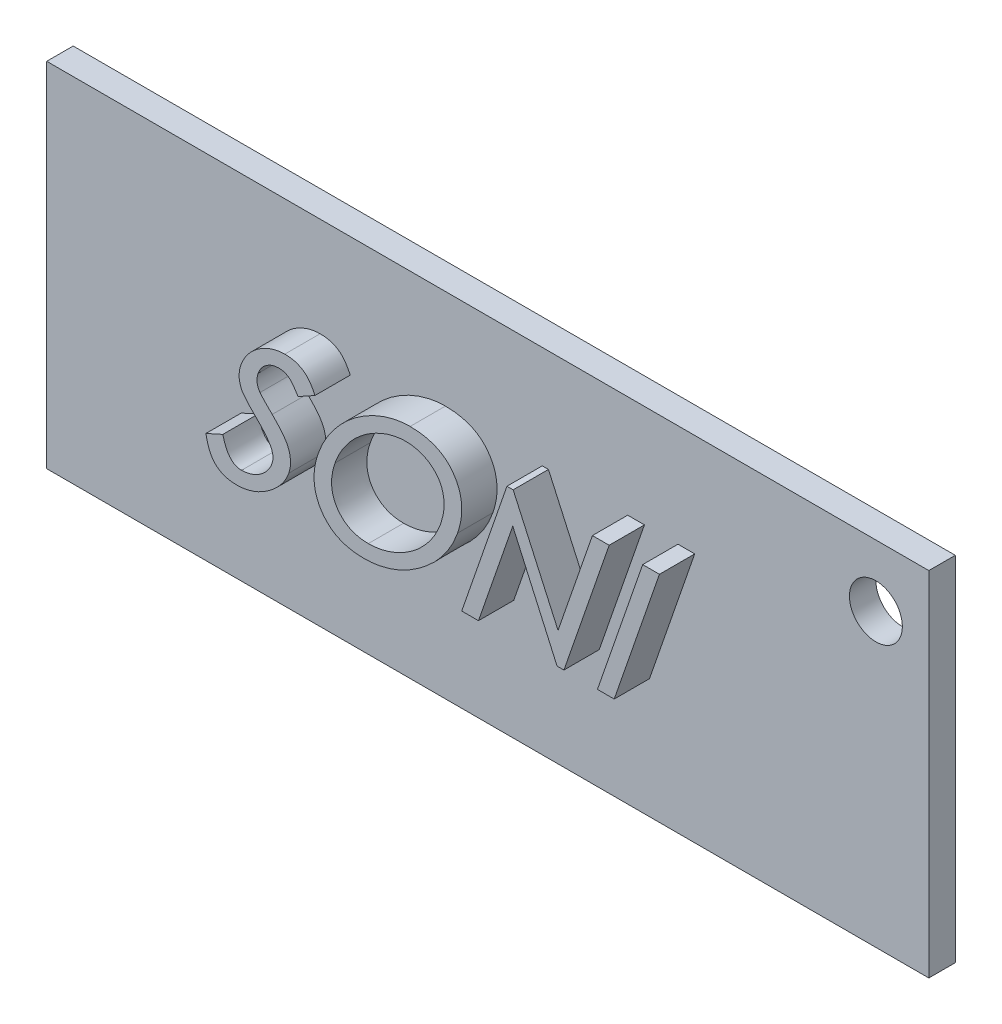
from build123d import *

# Parameters (mm, degrees)
SKETCH1_W           = 50
SKETCH1_H           = 20
BOSS_EXTRUDE1_DEPTH = 1.5
BOSS_EXTRUDE2_DEPTH = 2
SKETCH3_R           = 1.5
CUT_EXTRUDE1_DEPTH  = 2


with BuildPart() as part:
    # Sketch1 → Boss-Extrude1 (new body)
    with BuildSketch(Plane.XY):
        Rectangle(SKETCH1_W, SKETCH1_H)
    extrude(amount=BOSS_EXTRUDE1_DEPTH)

    # Sketch2 → Boss-Extrude2 (add)
    # profile 1 of 4: a face of its own
    with BuildSketch(Plane.XY.offset(1.5)):
        with BuildLine():
            Line((-13.974407972, -1.754997377), (-13.018685483, -1.324625449))
            add(Edge.make_bspline(
                [(-13.018685483, -1.324625449), (-12.993364568, -1.42166974), (-12.945414566, -1.605441693), (-12.848529546, -1.857451647), (-12.739942289, -2.072648376), (-12.61504846, -2.249545476), (-12.474055014, -2.388564201), (-12.316339112, -2.487707893), (-12.14297045, -2.548777648), (-12.021894937, -2.555793694), (-11.960564155, -2.559347671)],
                knots=[0, 0, 0, 0, 1.366242747, 2.587242303, 3.672994386, 4.644237624, 5.526474312, 6.353482186, 7.165956663, 8, 8, 8, 8], degree=3))
            add(Edge.make_bspline(
                [(-11.960564155, -2.559347671), (-11.900083725, -2.557296868), (-11.777358448, -2.553135435), (-11.593895672, -2.52041494), (-11.409012272, -2.469420024), (-11.225675647, -2.398665213), (-11.048322302, -2.310758517), (-10.88204974, -2.208380004), (-10.732148298, -2.090440819), (-10.597143765, -1.961541441), (-10.478446544, -1.823733448), (-10.377894757, -1.680683106), (-10.295137781, -1.53325765), (-10.25569109, -1.430531741), (-10.236108359, -1.379534971)],
                knots=[0, 0, 0, 0, 0.982389124, 1.993437814, 3.019335133, 4.095770719, 5.181531962, 6.23223351, 7.263064189, 8.275167036, 9.261364393, 10.213689592, 11.113212396, 12, 12, 12, 12], degree=3))
            add(Edge.make_bspline(
                [(-10.236108359, -1.379534971), (-10.219226733, -1.322574983), (-10.186080966, -1.21073845), (-10.171898073, -1.037182781), (-10.187143753, -0.864251701), (-10.222558444, -0.754267429), (-10.240560483, -0.698360091)],
                knots=[0, 0, 0, 0, 1.023665939, 2.009888962, 2.98838436, 4, 4, 4, 4], degree=3))
            add(Edge.make_bspline(
                [(-10.240560483, -0.698360091), (-10.257594599, -0.657915385), (-10.293555512, -0.572532119), (-10.366370183, -0.446189922), (-10.452596268, -0.312520238), (-10.55379879, -0.172117339), (-10.673253971, -0.027801546), (-10.806885161, 0.12411861), (-10.957451218, 0.281478827), (-11.064887481, 0.386780805), (-11.120596874, 0.441383499)],
                knots=[0, 0, 0, 0, 0.725921294, 1.53250051, 2.409358469, 3.35948991, 4.395527304, 5.509549822, 6.708616029, 8, 8, 8, 8], degree=3))
            add(Edge.make_bspline(
                [(-11.120596874, 0.441383499), (-11.177887412, 0.4963869), (-11.287421786, 0.601548474), (-11.43761624, 0.758078177), (-11.57287838, 0.899625927), (-11.686511858, 1.032743745), (-11.785431807, 1.151576703), (-11.863980376, 1.260535914), (-11.927004746, 1.355956276), (-11.956240391, 1.419026516), (-11.969468402, 1.447563387)],
                knots=[0, 0, 0, 0, 1.440931207, 2.754931364, 3.936117262, 4.992495269, 5.930372775, 6.740127158, 7.429955742, 8, 8, 8, 8], degree=3))
            add(Edge.make_bspline(
                [(-11.969468402, 1.447563387), (-11.987648022, 1.49176727), (-12.023826024, 1.579734356), (-12.062697609, 1.717461392), (-12.085769123, 1.858357451), (-12.09675556, 2.001923556), (-12.092066935, 2.148159206), (-12.071969454, 2.296977466), (-12.039666693, 2.44899459), (-12.007915886, 2.549450139), (-11.991729019, 2.600663347)],
                knots=[0, 0, 0, 0, 0.969882978, 1.930096936, 2.897689013, 3.864446688, 4.849193057, 5.86201719, 6.910035748, 8, 8, 8, 8], degree=3))
            add(Edge.make_bspline(
                [(-11.991729019, 2.600663347), (-11.960946721, 2.681633146), (-11.8989025, 2.844834355), (-11.771079087, 3.075575555), (-11.617875356, 3.295840338), (-11.440771341, 3.503987333), (-11.240808473, 3.696175353), (-11.022724971, 3.869146538), (-10.786102977, 4.017742567), (-10.536920831, 4.144804389), (-10.279609702, 4.246725663), (-10.019677689, 4.320262746), (-9.760774984, 4.364831989), (-9.588241864, 4.371030013), (-9.50299204, 4.3740925)],
                knots=[0, 0, 0, 0, 0.960482324, 1.935930141, 2.918338052, 3.934950457, 4.964001294, 5.99217285, 7.018862584, 8.06002957, 9.092896566, 10.08544053, 11.054002747, 12, 12, 12, 12], degree=3))
            add(Edge.make_bspline(
                [(-9.50299204, 4.3740925), (-9.409328331, 4.370865958), (-9.228224675, 4.364627271), (-8.966348002, 4.319208033), (-8.727535253, 4.237922418), (-8.543309239, 4.146011369), (-8.407898239, 4.052586), (-8.310280766, 3.969266339), (-8.215693456, 3.87273178), (-8.124517152, 3.763488718), (-8.036230017, 3.640501048), (-7.952382939, 3.504412734), (-7.87204409, 3.354817706), (-7.82211318, 3.249906581), (-7.796344737, 3.195763841)],
                knots=[0, 0, 0, 0, 1.517209808, 2.933604147, 4.286903352, 5.591513207, 6.253966455, 6.947629261, 7.667329603, 8.441002673, 9.250575696, 10.117904152, 11.028684271, 12, 12, 12, 12], degree=3))
            Line((-7.796344737, 3.195763841), (-8.755035309, 2.664477115))
            add(Edge.make_bspline(
                [(-8.755035309, 2.664477115), (-8.780573436, 2.707622626), (-8.829668615, 2.790566712), (-8.90346336, 2.908500623), (-8.976679968, 3.012905725), (-9.044223235, 3.108188602), (-9.112230974, 3.188594517), (-9.176810104, 3.258239198), (-9.238012011, 3.316331526), (-9.318002542, 3.375994871), (-9.422840557, 3.433938935), (-9.558420415, 3.485487769), (-9.707698976, 3.512857419), (-9.810583677, 3.517098703), (-9.863614035, 3.519284808)],
                knots=[0, 0, 0, 0, 1.215895862, 2.337470802, 3.372356939, 4.308146137, 5.168290878, 5.923677575, 6.611245207, 7.211060785, 8.338969284, 9.504341646, 10.713650776, 12, 12, 12, 12], degree=3))
            add(Edge.make_bspline(
                [(-9.863614035, 3.519284808), (-9.923235305, 3.516315308), (-10.043020192, 3.510349296), (-10.219742319, 3.465032832), (-10.392590395, 3.393197477), (-10.556772079, 3.292035731), (-10.709259256, 3.169796488), (-10.837807634, 3.023859983), (-10.943505555, 2.859548848), (-10.991024892, 2.738174331), (-11.015229954, 2.676349444)],
                knots=[0, 0, 0, 0, 0.941623222, 1.891811974, 2.866273965, 3.890870804, 4.930192469, 5.943899404, 6.952678138, 8, 8, 8, 8], degree=3))
            add(Edge.make_bspline(
                [(-11.015229954, 2.676349444), (-11.027981537, 2.637011963), (-11.053009737, 2.559802225), (-11.074789806, 2.442674602), (-11.084193196, 2.328754897), (-11.080165546, 2.217458722), (-11.060297912, 2.107704637), (-11.025849968, 1.999058838), (-10.976190568, 1.890251013), (-10.932506424, 1.821540441), (-10.909863033, 1.785924765)],
                knots=[0, 0, 0, 0, 1.061690431, 2.083835451, 3.05291063, 3.994329682, 4.936863702, 5.909766272, 6.916541013, 8, 8, 8, 8], degree=3))
            add(Edge.make_bspline(
                [(-10.909863033, 1.785924765), (-10.897687061, 1.769448347), (-10.870071426, 1.732079112), (-10.818071654, 1.672490698), (-10.752775877, 1.599773521), (-10.673386954, 1.514407685), (-10.578818028, 1.417498483), (-10.470951872, 1.308197071), (-10.349188219, 1.186069684), (-10.262445043, 1.101661513), (-10.216815824, 1.057260569)],
                knots=[0, 0, 0, 0, 0.488404034, 1.107721659, 1.884627782, 2.819503016, 3.887381442, 5.113651768, 6.481704013, 8, 8, 8, 8], degree=3))
            add(Edge.make_bspline(
                [(-10.216815824, 1.057260569), (-10.155087341, 0.996806545), (-10.035602952, 0.879789059), (-9.868550419, 0.703597621), (-9.72239839, 0.531075938), (-9.591635317, 0.366690927), (-9.4816069, 0.20646512), (-9.390681471, 0.051582966), (-9.316642498, -0.096640265), (-9.246202012, -0.285570984), (-9.192167793, -0.519995156), (-9.170023198, -0.80180398), (-9.196072213, -1.08441731), (-9.250045415, -1.265459345), (-9.277417788, -1.357274354)],
                knots=[0, 0, 0, 0, 1.126961503, 2.18139661, 3.16540865, 4.075407739, 4.920159245, 5.698125861, 6.416667466, 7.078222902, 8.324060742, 9.540477173, 10.752659238, 12, 12, 12, 12], degree=3))
            add(Edge.make_bspline(
                [(-9.277417788, -1.357274354), (-9.302349945, -1.423626934), (-9.352671061, -1.557547792), (-9.452452252, -1.749561371), (-9.566412636, -1.938146812), (-9.701428589, -2.119665296), (-9.854400358, -2.29604891), (-10.025611921, -2.467038278), (-10.21528545, -2.631579456), (-10.418710518, -2.790858196), (-10.634397741, -2.935348921), (-10.854470153, -3.064805245), (-11.079298143, -3.171533649), (-11.307216068, -3.259099331), (-11.53787689, -3.330204892), (-11.772405276, -3.378758257), (-12.0103034, -3.407532724), (-12.169736158, -3.411938612), (-12.249952176, -3.414155363)],
                knots=[0, 0, 0, 0, 0.888474965, 1.793228361, 2.709591257, 3.650401977, 4.627082336, 5.636340541, 6.683060695, 7.775419217, 8.87524379, 9.937485282, 10.975616154, 11.993234322, 12.998363101, 14.000018463, 14.993741594, 16, 16, 16, 16], degree=3))
            add(Edge.make_bspline(
                [(-12.249952176, -3.414155363), (-12.306376638, -3.412887599), (-12.416991483, -3.410402268), (-12.579467253, -3.394660852), (-12.733230185, -3.364848837), (-12.878861713, -3.323967362), (-13.017520222, -3.274920716), (-13.146758724, -3.209661229), (-13.269216458, -3.135913374), (-13.383504142, -3.049227499), (-13.488228568, -2.94676129), (-13.585313639, -2.828753506), (-13.673286274, -2.693010234), (-13.749229515, -2.538041314), (-13.821523037, -2.367856106), (-13.880990499, -2.178654389), (-13.933238492, -1.972964396), (-13.960360296, -1.829371163), (-13.974407972, -1.754997377)],
                knots=[0, 0, 0, 0, 1.016743274, 1.993229434, 2.937199628, 3.834660296, 4.717258582, 5.582263595, 6.438313194, 7.290455994, 8.16031522, 9.07217833, 10.038851953, 11.067287897, 12.178024352, 13.367542962, 14.636524905, 16, 16, 16, 16], degree=3))
        make_face()
    # profile 2 of 4: a face of its own
    with BuildSketch(Plane.XY.offset(1.5)):
        with BuildLine():
            add(Edge.make_bspline(
                [(-2.40037118, 4.3740925), (-2.329115812, 4.373266408), (-2.188950149, 4.371641412), (-1.982444266, 4.357970494), (-1.783340345, 4.335922127), (-1.59207346, 4.305034548), (-1.408766941, 4.264866969), (-1.23330481, 4.215980388), (-1.065284666, 4.158046511), (-0.904941175, 4.091627788), (-0.752862291, 4.015464985), (-0.608524045, 3.930775238), (-0.471623101, 3.837092008), (-0.342261172, 3.734376305), (-0.220246797, 3.623291716), (-0.10723324, 3.502219238), (-0.001576929, 3.372851309), (0.095719455, 3.235277912), (0.184813532, 3.091744708), (0.26328361, 2.943323294), (0.331718388, 2.791669108), (0.390355954, 2.636203256), (0.437180257, 2.476813045), (0.47441702, 2.313685909), (0.50282455, 2.147296162), (0.521047346, 1.976795242), (0.525895413, 1.802274885), (0.523492709, 1.624433065), (0.509896096, 1.443084531), (0.485657119, 1.257904281), (0.452074856, 1.069064514), (0.406251147, 0.876873741), (0.353987901, 0.680164051), (0.309754165, 0.549486585), (0.287227311, 0.482936651)],
                knots=[0, 0, 0, 0, 1.19369531, 2.348105145, 3.465600306, 4.548794009, 5.592458661, 6.60793664, 7.598661093, 8.568328124, 9.513458989, 10.445895592, 11.370007858, 12.290284303, 13.211269529, 14.131807167, 15.062474159, 16.007605024, 16.952881227, 17.89086296, 18.81820283, 19.738740468, 20.672281375, 21.599102619, 22.540592751, 23.498859082, 24.469092632, 25.463761039, 26.477614361, 27.513815442, 28.591637562, 29.689287715, 30.823226709, 32, 32, 32, 32], degree=3))
            add(Edge.make_bspline(
                [(0.287227311, 0.482936651), (0.237898348, 0.350966912), (0.139435589, 0.087549567), (-0.046652769, -0.292676621), (-0.264360672, -0.657982584), (-0.51089536, -1.010996172), (-0.789712849, -1.348018713), (-1.098330785, -1.67173653), (-1.438840117, -1.979726782), (-1.805008488, -2.270895837), (-2.18828956, -2.537332803), (-2.58083408, -2.771374651), (-2.978403443, -2.970003822), (-3.380696037, -3.132485297), (-3.788553555, -3.257547745), (-4.20069104, -3.348956387), (-4.618518788, -3.403734041), (-4.898844125, -3.410681762), (-5.038996313, -3.414155363)],
                knots=[0, 0, 0, 0, 0.965800603, 1.927780069, 2.898282571, 3.879946096, 4.877733712, 5.89516875, 6.944716955, 8.024001756, 9.101562889, 10.143627197, 11.155617605, 12.146599204, 13.115635926, 14.077908484, 15.039026101, 16, 16, 16, 16], degree=3))
            add(Edge.make_bspline(
                [(-5.038996313, -3.414155363), (-5.106295635, -3.413320037), (-5.239050615, -3.411672267), (-5.434189598, -3.398091601), (-5.622465182, -3.376092746), (-5.80348886, -3.344175435), (-5.978588085, -3.307363049), (-6.145273418, -3.256532068), (-6.306039099, -3.202158966), (-6.457781829, -3.132958307), (-6.605298873, -3.060999127), (-6.742929104, -2.974329259), (-6.87627929, -2.883845379), (-6.998887053, -2.779780784), (-7.116869704, -2.669926427), (-7.228443183, -2.551743931), (-7.330770895, -2.422752296), (-7.426861761, -2.287283558), (-7.51431816, -2.145112698), (-7.591688171, -1.99787074), (-7.658446023, -1.846561692), (-7.714548532, -1.691624538), (-7.762822398, -1.533872542), (-7.799581535, -1.372138738), (-7.826521337, -1.206604457), (-7.842625079, -1.037556823), (-7.848669664, -0.864587103), (-7.843519959, -0.687763215), (-7.830643204, -0.506901991), (-7.806623739, -0.322630085), (-7.772155371, -0.134973094), (-7.727692532, 0.056213389), (-7.672345904, 0.251054576), (-7.629599993, 0.381176472), (-7.607871514, 0.447319663)],
                knots=[0, 0, 0, 0, 1.152857882, 2.274133261, 3.349502609, 4.398637837, 5.422655992, 6.41218139, 7.382466674, 8.327287206, 9.267230032, 10.191647644, 11.110884003, 12.025616675, 12.942975922, 13.872314084, 14.806739057, 15.761390706, 16.716343246, 17.664048038, 18.60886857, 19.547243644, 20.485618719, 21.433361403, 22.386356454, 23.356974782, 24.340639887, 25.349465624, 26.386204989, 27.445796577, 28.531270378, 29.653698147, 30.807334513, 32, 32, 32, 32], degree=3))
            add(Edge.make_bspline(
                [(-7.607871514, 0.447319663), (-7.575728616, 0.535766327), (-7.511273989, 0.713124225), (-7.396071658, 0.972971975), (-7.266577378, 1.228149264), (-7.124554058, 1.479442028), (-6.966376562, 1.724737858), (-6.794014735, 1.965434818), (-6.607081995, 2.200994097), (-6.406928636, 2.430679981), (-6.196384411, 2.651434011), (-5.977459339, 2.861873523), (-5.750768211, 3.059212644), (-5.515677384, 3.242825089), (-5.274833875, 3.416341209), (-5.025446224, 3.575567914), (-4.769964647, 3.725538595), (-4.506456169, 3.858789394), (-4.24134818, 3.98104774), (-3.974646482, 4.084271385), (-3.710172957, 4.174511568), (-3.446408159, 4.246695152), (-3.183487507, 4.304287807), (-2.921626095, 4.343054028), (-2.660665082, 4.370641293), (-2.487011703, 4.372943743), (-2.40037118, 4.3740925)],
                knots=[0, 0, 0, 0, 0.980143043, 1.96543435, 2.958765697, 3.960404016, 4.971069614, 5.997885197, 7.043373198, 8.102652665, 9.170658746, 10.220367732, 11.265106092, 12.300165184, 13.326980766, 14.356224728, 15.38153908, 16.411775992, 17.431115419, 18.421608671, 19.389632625, 20.341067018, 21.268972419, 22.191682806, 23.097780028, 24, 24, 24, 24], degree=3))
        make_face()
        with BuildLine():
            add(Edge.make_bspline(
                [(-2.666014542, 3.519284808), (-2.728889823, 3.518243144), (-2.85592221, 3.516138579), (-3.047174589, 3.495593089), (-3.240897844, 3.464483423), (-3.436999882, 3.420999399), (-3.635984964, 3.366586664), (-3.836233338, 3.297534821), (-4.039011682, 3.217333245), (-4.242206458, 3.123952484), (-4.444470668, 3.020930837), (-4.642067504, 2.907993318), (-4.834231982, 2.785724989), (-5.02128502, 2.65453818), (-5.200292439, 2.510678816), (-5.376485508, 2.360815918), (-5.547233955, 2.201182906), (-5.70901769, 2.030259963), (-5.86571766, 1.854483537), (-6.01052574, 1.670863168), (-6.144367066, 1.48109045), (-6.269798863, 1.287416354), (-6.382050776, 1.085835341), (-6.486246082, 0.880423546), (-6.579222272, 0.668449241), (-6.631685017, 0.523319549), (-6.658085189, 0.450287746)],
                knots=[0, 0, 0, 0, 0.848377632, 1.714050969, 2.593290597, 3.495650987, 4.423826135, 5.376087873, 6.353097408, 7.365974628, 8.393186759, 9.415962607, 10.436556764, 11.466542689, 12.497826262, 13.534886172, 14.588239105, 15.650778183, 16.710397299, 17.765674127, 18.804966953, 19.844002381, 20.878393667, 21.917514901, 22.952057019, 24, 24, 24, 24], degree=3))
            add(Edge.make_bspline(
                [(-6.658085189, 0.450287746), (-6.692224441, 0.344978376), (-6.758187172, 0.141503101), (-6.821877106, -0.163847783), (-6.856050947, -0.454987619), (-6.857008116, -0.733028167), (-6.824027315, -0.997208387), (-6.76048315, -1.247829014), (-6.664691728, -1.485325627), (-6.536881928, -1.705037852), (-6.384849062, -1.905102639), (-6.210923234, -2.080344716), (-6.018724514, -2.230489517), (-5.805354417, -2.351291331), (-5.573307251, -2.445301545), (-5.322466999, -2.511317692), (-5.052715755, -2.552407761), (-4.866507093, -2.556984913), (-4.770384868, -2.559347671)],
                knots=[0, 0, 0, 0, 1.239344653, 2.394620662, 3.487546551, 4.518238436, 5.501106608, 6.46206435, 7.406698664, 8.360020979, 9.300974908, 10.213954007, 11.118417775, 12.024306323, 12.951452884, 13.91521849, 14.923821074, 16, 16, 16, 16], degree=3))
            add(Edge.make_bspline(
                [(-4.770384868, -2.559347671), (-4.70059016, -2.558310268), (-4.560240186, -2.556224157), (-4.350170195, -2.535931362), (-4.139698763, -2.504533884), (-3.928855299, -2.46203896), (-3.717734653, -2.404513491), (-3.505650071, -2.337320166), (-3.294374683, -2.254159822), (-3.082820999, -2.161875987), (-2.875509087, -2.056486343), (-2.672302195, -1.943796872), (-2.476166013, -1.820366693), (-2.287077276, -1.68681866), (-2.103240951, -1.545464204), (-1.927003216, -1.394252189), (-1.757654372, -1.233276749), (-1.594591622, -1.064992285), (-1.441216673, -0.888640907), (-1.296083715, -0.707992159), (-1.165295769, -0.52004097), (-1.040593945, -0.330443918), (-0.929016246, -0.134156915), (-0.831040599, 0.068141884), (-0.738233735, 0.272859357), (-0.68782213, 0.413793427), (-0.662559014, 0.484420692)],
                knots=[0, 0, 0, 0, 0.925682771, 1.861452755, 2.796969583, 3.748077339, 4.712740439, 5.698534164, 6.697865235, 7.723336334, 8.759336503, 9.78173726, 10.805001166, 11.831857215, 12.851769708, 13.88032292, 14.91086307, 15.950473513, 16.987616219, 18.010459167, 19.022806367, 20.023945794, 21.020255645, 22.015181311, 23.005334083, 24, 24, 24, 24], degree=3))
            add(Edge.make_bspline(
                [(-0.662559014, 0.484420692), (-0.640018525, 0.553941175), (-0.595899816, 0.69001427), (-0.544055904, 0.894215412), (-0.504824753, 1.092763301), (-0.48078127, 1.28666919), (-0.471541424, 1.475703053), (-0.477685208, 1.659763659), (-0.496893193, 1.838880141), (-0.529359338, 2.012120488), (-0.574886088, 2.179368625), (-0.636361762, 2.337801961), (-0.708850126, 2.4887772), (-0.795380843, 2.630448221), (-0.895765961, 2.76319983), (-1.008646698, 2.888210204), (-1.135419784, 3.004393252), (-1.274670819, 3.110051722), (-1.42259848, 3.207435821), (-1.580418702, 3.289556866), (-1.74370921, 3.361417125), (-1.914373233, 3.419959166), (-2.092387689, 3.463529643), (-2.277174449, 3.496679294), (-2.46919791, 3.516302996), (-2.599682257, 3.51827986), (-2.666014542, 3.519284808)],
                knots=[0, 0, 0, 0, 1.200309743, 2.349377555, 3.458617634, 4.523015105, 5.556213374, 6.564405596, 7.545273869, 8.512719815, 9.457091831, 10.388260122, 11.300513653, 12.205024838, 13.110302296, 14.030842988, 14.968337054, 15.930546957, 16.899766032, 17.873980152, 18.849278237, 19.828394477, 20.833569135, 21.856973834, 22.91058332, 24, 24, 24, 24], degree=3))
        make_face(mode=Mode.SUBTRACT)
    # profile 3 of 4: a face of its own
    with BuildSketch(Plane.XY.offset(1.5)):
        Polygon((0.523189851, -3.224198098), (3.087612928, 4.184135235), (3.439330677, 4.184135235), (5.982977178, -1.44483278), (7.931523185, 4.184135235), (8.881309509, 4.184135235), (6.316886432, -3.224198098), (5.928067656, -3.224198098), (3.41707006, 2.389929506), (1.472976176, -3.224198098), align=None)
    # profile 4 of 4: a face of its own
    with BuildSketch(Plane.XY.offset(1.5)):
        Polygon((10.780882159, 4.184135235), (11.730668484, 4.184135235), (9.166245407, -3.224198098), (8.216459082, -3.224198098), align=None)
    extrude(amount=BOSS_EXTRUDE2_DEPTH)

    # Sketch3 → Cut-Extrude1 (cut)
    with BuildSketch(Plane.XY.offset(1.5)):
        with Locations((22, 6.5)):
            Circle(SKETCH3_R)
    extrude(amount=-CUT_EXTRUDE1_DEPTH, mode=Mode.SUBTRACT)


solid = part.part
